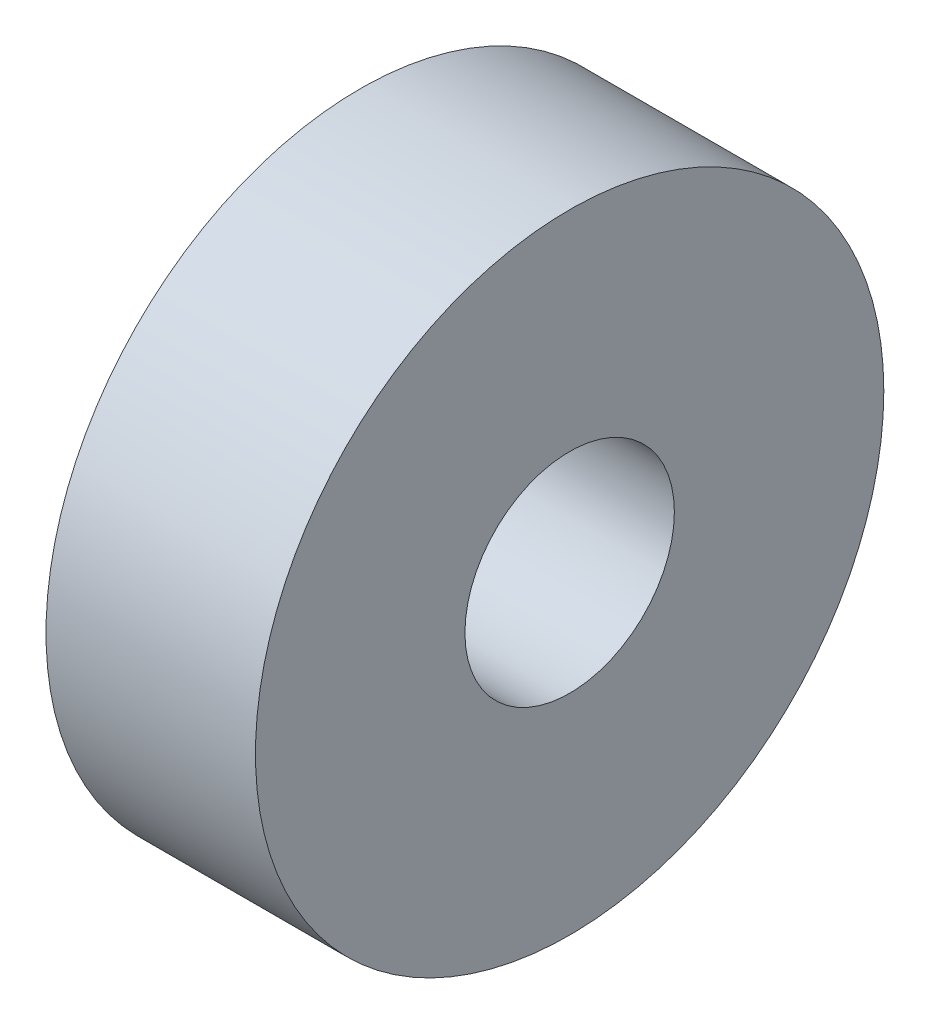
from build123d import *

# Parameters (mm, degrees)
SKETCH_1_R      = 6
SKETCH_1_R_2    = 2
EXTRUDE_1_DEPTH = 4


with BuildPart() as part:
    # 草图1 → 凸台-拉伸1 (new body)
    with BuildSketch(Plane(origin=(0, 0, 0), x_dir=(0, 0, -1), z_dir=(1, 0, 0))):
        Circle(SKETCH_1_R)
        Circle(SKETCH_1_R_2, mode=Mode.SUBTRACT)
    extrude(amount=EXTRUDE_1_DEPTH)


solid = part.part
